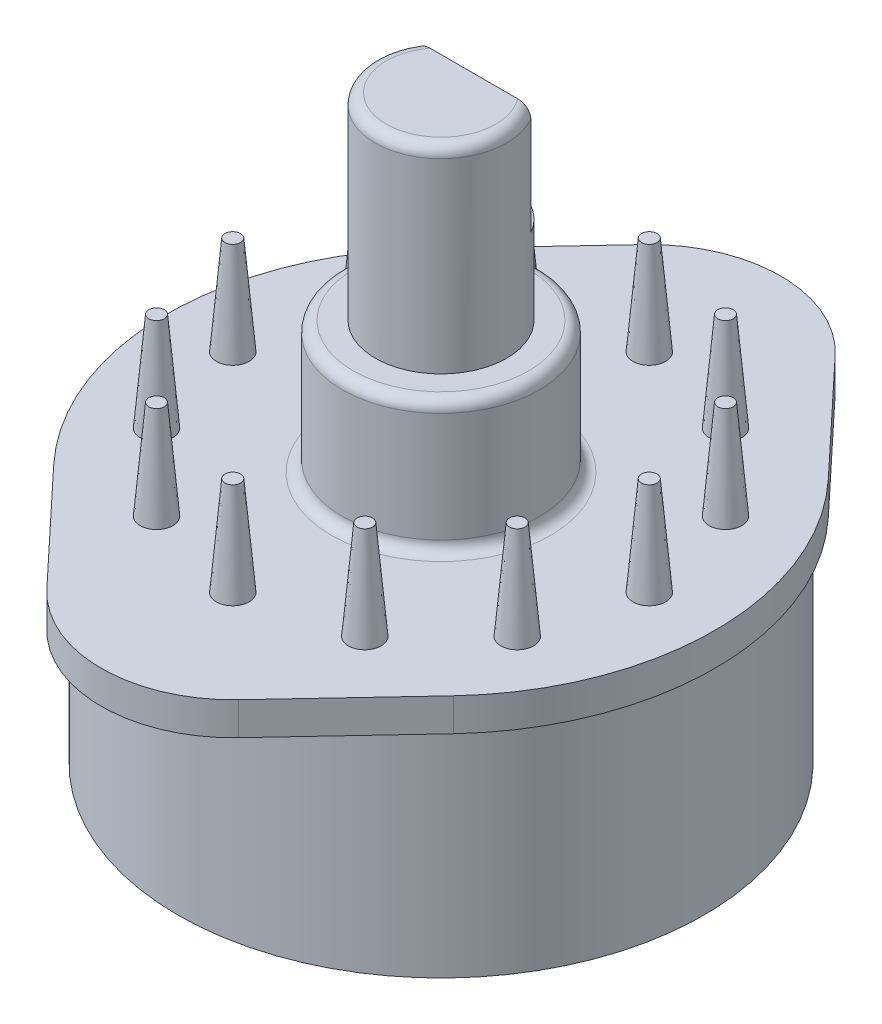
from build123d import *

# Parameters (mm, degrees)
CUT_EXTRUDE1_START             = -5
CUT_EXTRUDE1_DEPTH             = 5
FILLET1_R                      = 0.5
BOSS_EXTRUDE1_DEPTH            = 1.5
SKETCH4_R                      = 0.75
BOSS_EXTRUDE2_DEPTH            = 4.5
BOSS_EXTRUDE2_DRAFT            = 5
BOSS_EXTRUDE2_PROFILE_2_DEPTH  = 4.5
BOSS_EXTRUDE2_PROFILE_2_DRAFT  = 5
BOSS_EXTRUDE2_PROFILE_3_DEPTH  = 4.5
BOSS_EXTRUDE2_PROFILE_3_DRAFT  = 5
BOSS_EXTRUDE2_PROFILE_4_DEPTH  = 4.5
BOSS_EXTRUDE2_PROFILE_4_DRAFT  = 5
BOSS_EXTRUDE2_PROFILE_5_DEPTH  = 4.5
BOSS_EXTRUDE2_PROFILE_5_DRAFT  = 5
BOSS_EXTRUDE2_PROFILE_6_DEPTH  = 4.5
BOSS_EXTRUDE2_PROFILE_6_DRAFT  = 5
BOSS_EXTRUDE2_PROFILE_7_DEPTH  = 4.5
BOSS_EXTRUDE2_PROFILE_7_DRAFT  = 5
BOSS_EXTRUDE2_PROFILE_8_DEPTH  = 4.5
BOSS_EXTRUDE2_PROFILE_8_DRAFT  = 5
BOSS_EXTRUDE2_PROFILE_9_DEPTH  = 4.5
BOSS_EXTRUDE2_PROFILE_9_DRAFT  = 5
BOSS_EXTRUDE2_PROFILE_10_DEPTH = 4.5
BOSS_EXTRUDE2_PROFILE_10_DRAFT = 5
BOSS_EXTRUDE2_PROFILE_11_DEPTH = 4.5
BOSS_EXTRUDE2_PROFILE_11_DRAFT = 5
BOSS_EXTRUDE2_PROFILE_12_DEPTH = 4.5
BOSS_EXTRUDE2_PROFILE_12_DRAFT = 5


with BuildPart() as part:
    # Sketch1 → Revolve1 (revolve)
    with BuildSketch(Plane(origin=(0, 0, 0), x_dir=(0, 0, -1), z_dir=(1, 0, 0))):
        Polygon((4.5, 17.5), (4.5, 11.5), (12, 11.5), (12, 0), (6, 0), (6, -3), (0, -3), (0, 0), (0, 26.5), (3, 26.5), (3, 17.5), align=None)
    revolve(axis=Axis((0, 0, 0), (0, 1, 0)))

    # Sketch2 → Cut-Extrude1 (cut)
    with BuildSketch(Plane(origin=(0, 26.5, 0), x_dir=(1, 0, 0), z_dir=(0, 1, 0)).offset(CUT_EXTRUDE1_START)):
        with BuildLine():
            Line((2.598076211, 1.5), (-2.598076211, 1.5))
            ThreePointArc((-2.598076211, 1.5), (0, 3), (2.598076211, 1.5))
        make_face()
    extrude(amount=CUT_EXTRUDE1_DEPTH, mode=Mode.SUBTRACT)

    # Fillet1
    fillet1_edges = [part.edges().sort_by_distance(p)[0] for p in [
        (0, 11.5, 4.5),
        (0, 17.5, 4.5),
        (0, 26.5, 3),
        (0, -3, 6),
    ]]
    fillet(fillet1_edges, radius=FILLET1_R)

    # Sketch3 → Boss-Extrude1 (add)
    with BuildSketch(Plane(origin=(0, 11.5, 0), x_dir=(1, 0, 0), z_dir=(0, 1, 0))):
        with BuildLine():
            Line((-9.116056882, 8.552631579), (-4.375707303, 13.605263158))
            ThreePointArc((-4.375707303, 13.605263158), (0, 15.5), (4.375707303, 13.605263158))
            Line((4.375707303, 13.605263158), (9.116056882, 8.552631579))
            ThreePointArc((9.116056882, 8.552631579), (12.5, 0), (9.116056882, -8.552631579))
            Line((9.116056882, -8.552631579), (4.375707303, -13.605263158))
            ThreePointArc((4.375707303, -13.605263158), (0, -15.5), (-4.375707303, -13.605263158))
            Line((-4.375707303, -13.605263158), (-9.116056882, -8.552631579))
            ThreePointArc((-9.116056882, -8.552631579), (-12.5, 0), (-9.116056882, 8.552631579))
        make_face()
    extrude(amount=-BOSS_EXTRUDE1_DEPTH)


with BuildPart() as boss_extrude2_tool:
    # Sketch4 → Boss-Extrude2 (with draft: the straight prism first)
    with BuildSketch(Plane(origin=(0, 11.5, 0), x_dir=(1, 0, 0), z_dir=(0, 1, 0))):
        with Locations((0, -9.5)):
            Circle(SKETCH4_R)
    extrude(amount=BOSS_EXTRUDE2_DEPTH)
    # Boss-Extrude2: the draft: its side faces are tilted about the plane it starts from
    boss_extrude2_sides = [boss_extrude2_tool.faces().sort_by_distance(p)[0] for p in [
        (-0.75, 13.75, 9.5),
    ]]
    draft(boss_extrude2_sides, Plane(origin=(0, 11.5, 0), x_dir=(1, 0, 0), z_dir=(0, 1, 0)), BOSS_EXTRUDE2_DRAFT)


with BuildPart() as part_1:
    add(part.part)

    # Boss-Extrude2: add boss_extrude2_tool
    add(boss_extrude2_tool.part)


with BuildPart() as boss_extrude2_profile_2_tool:
    # Sketch4 → Boss-Extrude2 profile 2 (with draft: the straight prism first)
    with BuildSketch(Plane(origin=(0, 11.5, 0), x_dir=(1, 0, 0), z_dir=(0, 1, 0))):
        with Locations((-4.75, -8.227241336)):
            Circle(SKETCH4_R)
    extrude(amount=BOSS_EXTRUDE2_PROFILE_2_DEPTH)
    # Boss-Extrude2 profile 2: the draft: its side faces are tilted about the plane it starts from
    boss_extrude2_profile_2_sides = [boss_extrude2_profile_2_tool.faces().sort_by_distance(p)[0] for p in [
        (-5.5, 13.75, 8.227241336),
    ]]
    draft(boss_extrude2_profile_2_sides, Plane(origin=(0, 11.5, 0), x_dir=(1, 0, 0), z_dir=(0, 1, 0)), BOSS_EXTRUDE2_PROFILE_2_DRAFT)


with BuildPart() as part_2:
    add(part_1.part)

    # Boss-Extrude2 profile 2: add boss_extrude2_profile_2_tool
    add(boss_extrude2_profile_2_tool.part)


with BuildPart() as boss_extrude2_profile_3_tool:
    # Sketch4 → Boss-Extrude2 profile 3 (with draft: the straight prism first)
    with BuildSketch(Plane(origin=(0, 11.5, 0), x_dir=(1, 0, 0), z_dir=(0, 1, 0))):
        with Locations((-8.227241336, -4.75)):
            Circle(SKETCH4_R)
    extrude(amount=BOSS_EXTRUDE2_PROFILE_3_DEPTH)
    # Boss-Extrude2 profile 3: the draft: its side faces are tilted about the plane it starts from
    boss_extrude2_profile_3_sides = [boss_extrude2_profile_3_tool.faces().sort_by_distance(p)[0] for p in [
        (-8.977241336, 13.75, 4.75),
    ]]
    draft(boss_extrude2_profile_3_sides, Plane(origin=(0, 11.5, 0), x_dir=(1, 0, 0), z_dir=(0, 1, 0)), BOSS_EXTRUDE2_PROFILE_3_DRAFT)


with BuildPart() as part_3:
    add(part_2.part)

    # Boss-Extrude2 profile 3: add boss_extrude2_profile_3_tool
    add(boss_extrude2_profile_3_tool.part)


with BuildPart() as boss_extrude2_profile_4_tool:
    # Sketch4 → Boss-Extrude2 profile 4 (with draft: the straight prism first)
    with BuildSketch(Plane(origin=(0, 11.5, 0), x_dir=(1, 0, 0), z_dir=(0, 1, 0))):
        with Locations((-9.5, 0)):
            Circle(SKETCH4_R)
    extrude(amount=BOSS_EXTRUDE2_PROFILE_4_DEPTH)
    # Boss-Extrude2 profile 4: the draft: its side faces are tilted about the plane it starts from
    boss_extrude2_profile_4_sides = [boss_extrude2_profile_4_tool.faces().sort_by_distance(p)[0] for p in [
        (-10.25, 13.75, 0),
    ]]
    draft(boss_extrude2_profile_4_sides, Plane(origin=(0, 11.5, 0), x_dir=(1, 0, 0), z_dir=(0, 1, 0)), BOSS_EXTRUDE2_PROFILE_4_DRAFT)


with BuildPart() as part_4:
    add(part_3.part)

    # Boss-Extrude2 profile 4: add boss_extrude2_profile_4_tool
    add(boss_extrude2_profile_4_tool.part)


with BuildPart() as boss_extrude2_profile_5_tool:
    # Sketch4 → Boss-Extrude2 profile 5 (with draft: the straight prism first)
    with BuildSketch(Plane(origin=(0, 11.5, 0), x_dir=(1, 0, 0), z_dir=(0, 1, 0))):
        with Locations((-8.227241336, 4.75)):
            Circle(SKETCH4_R)
    extrude(amount=BOSS_EXTRUDE2_PROFILE_5_DEPTH)
    # Boss-Extrude2 profile 5: the draft: its side faces are tilted about the plane it starts from
    boss_extrude2_profile_5_sides = [boss_extrude2_profile_5_tool.faces().sort_by_distance(p)[0] for p in [
        (-8.977241336, 13.75, -4.75),
    ]]
    draft(boss_extrude2_profile_5_sides, Plane(origin=(0, 11.5, 0), x_dir=(1, 0, 0), z_dir=(0, 1, 0)), BOSS_EXTRUDE2_PROFILE_5_DRAFT)


with BuildPart() as part_5:
    add(part_4.part)

    # Boss-Extrude2 profile 5: add boss_extrude2_profile_5_tool
    add(boss_extrude2_profile_5_tool.part)


with BuildPart() as boss_extrude2_profile_6_tool:
    # Sketch4 → Boss-Extrude2 profile 6 (with draft: the straight prism first)
    with BuildSketch(Plane(origin=(0, 11.5, 0), x_dir=(1, 0, 0), z_dir=(0, 1, 0))):
        with Locations((-4.75, 8.227241336)):
            Circle(SKETCH4_R)
    extrude(amount=BOSS_EXTRUDE2_PROFILE_6_DEPTH)
    # Boss-Extrude2 profile 6: the draft: its side faces are tilted about the plane it starts from
    boss_extrude2_profile_6_sides = [boss_extrude2_profile_6_tool.faces().sort_by_distance(p)[0] for p in [
        (-5.5, 13.75, -8.227241336),
    ]]
    draft(boss_extrude2_profile_6_sides, Plane(origin=(0, 11.5, 0), x_dir=(1, 0, 0), z_dir=(0, 1, 0)), BOSS_EXTRUDE2_PROFILE_6_DRAFT)


with BuildPart() as part_6:
    add(part_5.part)

    # Boss-Extrude2 profile 6: add boss_extrude2_profile_6_tool
    add(boss_extrude2_profile_6_tool.part)


with BuildPart() as boss_extrude2_profile_7_tool:
    # Sketch4 → Boss-Extrude2 profile 7 (with draft: the straight prism first)
    with BuildSketch(Plane(origin=(0, 11.5, 0), x_dir=(1, 0, 0), z_dir=(0, 1, 0))):
        with Locations((0, 9.5)):
            Circle(SKETCH4_R)
    extrude(amount=BOSS_EXTRUDE2_PROFILE_7_DEPTH)
    # Boss-Extrude2 profile 7: the draft: its side faces are tilted about the plane it starts from
    boss_extrude2_profile_7_sides = [boss_extrude2_profile_7_tool.faces().sort_by_distance(p)[0] for p in [
        (-0.75, 13.75, -9.5),
    ]]
    draft(boss_extrude2_profile_7_sides, Plane(origin=(0, 11.5, 0), x_dir=(1, 0, 0), z_dir=(0, 1, 0)), BOSS_EXTRUDE2_PROFILE_7_DRAFT)


with BuildPart() as part_7:
    add(part_6.part)

    # Boss-Extrude2 profile 7: add boss_extrude2_profile_7_tool
    add(boss_extrude2_profile_7_tool.part)


with BuildPart() as boss_extrude2_profile_8_tool:
    # Sketch4 → Boss-Extrude2 profile 8 (with draft: the straight prism first)
    with BuildSketch(Plane(origin=(0, 11.5, 0), x_dir=(1, 0, 0), z_dir=(0, 1, 0))):
        with Locations((4.75, 8.227241336)):
            Circle(SKETCH4_R)
    extrude(amount=BOSS_EXTRUDE2_PROFILE_8_DEPTH)
    # Boss-Extrude2 profile 8: the draft: its side faces are tilted about the plane it starts from
    boss_extrude2_profile_8_sides = [boss_extrude2_profile_8_tool.faces().sort_by_distance(p)[0] for p in [
        (4, 13.75, -8.227241336),
    ]]
    draft(boss_extrude2_profile_8_sides, Plane(origin=(0, 11.5, 0), x_dir=(1, 0, 0), z_dir=(0, 1, 0)), BOSS_EXTRUDE2_PROFILE_8_DRAFT)


with BuildPart() as part_8:
    add(part_7.part)

    # Boss-Extrude2 profile 8: add boss_extrude2_profile_8_tool
    add(boss_extrude2_profile_8_tool.part)


with BuildPart() as boss_extrude2_profile_9_tool:
    # Sketch4 → Boss-Extrude2 profile 9 (with draft: the straight prism first)
    with BuildSketch(Plane(origin=(0, 11.5, 0), x_dir=(1, 0, 0), z_dir=(0, 1, 0))):
        with Locations((8.227241336, 4.75)):
            Circle(SKETCH4_R)
    extrude(amount=BOSS_EXTRUDE2_PROFILE_9_DEPTH)
    # Boss-Extrude2 profile 9: the draft: its side faces are tilted about the plane it starts from
    boss_extrude2_profile_9_sides = [boss_extrude2_profile_9_tool.faces().sort_by_distance(p)[0] for p in [
        (7.477241336, 13.75, -4.75),
    ]]
    draft(boss_extrude2_profile_9_sides, Plane(origin=(0, 11.5, 0), x_dir=(1, 0, 0), z_dir=(0, 1, 0)), BOSS_EXTRUDE2_PROFILE_9_DRAFT)


with BuildPart() as part_9:
    add(part_8.part)

    # Boss-Extrude2 profile 9: add boss_extrude2_profile_9_tool
    add(boss_extrude2_profile_9_tool.part)


with BuildPart() as boss_extrude2_profile_10_tool:
    # Sketch4 → Boss-Extrude2 profile 10 (with draft: the straight prism first)
    with BuildSketch(Plane(origin=(0, 11.5, 0), x_dir=(1, 0, 0), z_dir=(0, 1, 0))):
        with Locations((9.5, 0)):
            Circle(SKETCH4_R)
    extrude(amount=BOSS_EXTRUDE2_PROFILE_10_DEPTH)
    # Boss-Extrude2 profile 10: the draft: its side faces are tilted about the plane it starts from
    boss_extrude2_profile_10_sides = [boss_extrude2_profile_10_tool.faces().sort_by_distance(p)[0] for p in [
        (8.75, 13.75, 0),
    ]]
    draft(boss_extrude2_profile_10_sides, Plane(origin=(0, 11.5, 0), x_dir=(1, 0, 0), z_dir=(0, 1, 0)), BOSS_EXTRUDE2_PROFILE_10_DRAFT)


with BuildPart() as part_10:
    add(part_9.part)

    # Boss-Extrude2 profile 10: add boss_extrude2_profile_10_tool
    add(boss_extrude2_profile_10_tool.part)


with BuildPart() as boss_extrude2_profile_11_tool:
    # Sketch4 → Boss-Extrude2 profile 11 (with draft: the straight prism first)
    with BuildSketch(Plane(origin=(0, 11.5, 0), x_dir=(1, 0, 0), z_dir=(0, 1, 0))):
        with Locations((8.227241336, -4.75)):
            Circle(SKETCH4_R)
    extrude(amount=BOSS_EXTRUDE2_PROFILE_11_DEPTH)
    # Boss-Extrude2 profile 11: the draft: its side faces are tilted about the plane it starts from
    boss_extrude2_profile_11_sides = [boss_extrude2_profile_11_tool.faces().sort_by_distance(p)[0] for p in [
        (7.477241336, 13.75, 4.75),
    ]]
    draft(boss_extrude2_profile_11_sides, Plane(origin=(0, 11.5, 0), x_dir=(1, 0, 0), z_dir=(0, 1, 0)), BOSS_EXTRUDE2_PROFILE_11_DRAFT)


with BuildPart() as part_11:
    add(part_10.part)

    # Boss-Extrude2 profile 11: add boss_extrude2_profile_11_tool
    add(boss_extrude2_profile_11_tool.part)


with BuildPart() as boss_extrude2_profile_12_tool:
    # Sketch4 → Boss-Extrude2 profile 12 (with draft: the straight prism first)
    with BuildSketch(Plane(origin=(0, 11.5, 0), x_dir=(1, 0, 0), z_dir=(0, 1, 0))):
        with Locations((4.75, -8.227241336)):
            Circle(SKETCH4_R)
    extrude(amount=BOSS_EXTRUDE2_PROFILE_12_DEPTH)
    # Boss-Extrude2 profile 12: the draft: its side faces are tilted about the plane it starts from
    boss_extrude2_profile_12_sides = [boss_extrude2_profile_12_tool.faces().sort_by_distance(p)[0] for p in [
        (4, 13.75, 8.227241336),
    ]]
    draft(boss_extrude2_profile_12_sides, Plane(origin=(0, 11.5, 0), x_dir=(1, 0, 0), z_dir=(0, 1, 0)), BOSS_EXTRUDE2_PROFILE_12_DRAFT)


with BuildPart() as part_12:
    add(part_11.part)

    # Boss-Extrude2 profile 12: add boss_extrude2_profile_12_tool
    add(boss_extrude2_profile_12_tool.part)


solid = part_12.part
